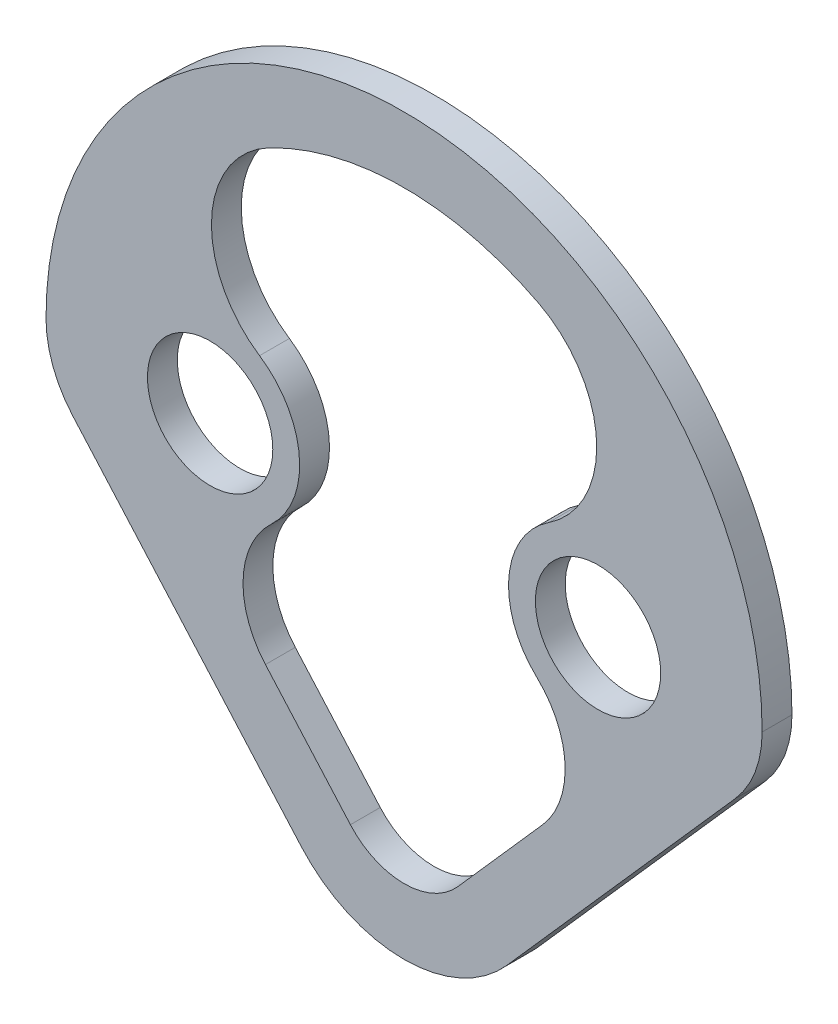
from build123d import *

# Parameters (mm, degrees)
SZKIC1_R                    = 10.5
DODANIE_WYCI_GNI_CIE1_DEPTH = 5


with BuildPart() as part:
    # Szkic1 → Dodanie-wyciągnięcie1 (new body)
    with BuildSketch(Plane.XY):
        with BuildLine():
            Line((-17.23880927, -15.225749734), (-55.491242037, 28.084195861))
            ThreePointArc((-55.491242037, 28.084195861), (-58.835117414, 33.629849165), (-60, 40))
            ThreePointArc((-60, 40), (0, 100), (60, 40))
            ThreePointArc((60, 40), (58.835117414, 33.629849165), (55.491242037, 28.084195861))
            Line((55.491242037, 28.084195861), (17.23880927, -15.225749734))
            ThreePointArc((17.23880927, -15.225749734), (0, -23), (-17.23880927, -15.225749734))
        make_face()
        with Locations((-32.5, 40)):
            Circle(SZKIC1_R, mode=Mode.SUBTRACT)
        with Locations((32.5, 40)):
            Circle(SZKIC1_R, mode=Mode.SUBTRACT)
        with BuildLine():
            Line((-23.232277997, 8.17672768), (-8.994161358, -7.943869426))
            ThreePointArc((-8.994161358, -7.943869426), (0, -12), (8.994161358, -7.943869426))
            Line((8.994161358, -7.943869426), (23.232277997, 8.17672768))
            ThreePointArc((23.232277997, 8.17672768), (26.972823751, 18.81529275), (22.24478815, 29.053282232))
            ThreePointArc((22.24478815, 29.053282232), (17.552836173, 41.257892492), (24.218531469, 52.506689369))
            ThreePointArc((24.218531469, 52.506689369), (32.255432897, 68.469423949), (22.572828784, 83.491003675))
            ThreePointArc((22.572828784, 83.491003675), (0, 89), (-22.572828784, 83.491003675))
            ThreePointArc((-22.572828784, 83.491003675), (-32.255432897, 68.469423949), (-24.218531469, 52.506689369))
            ThreePointArc((-24.218531469, 52.506689369), (-17.552836173, 41.257892492), (-22.24478815, 29.053282232))
            ThreePointArc((-22.24478815, 29.053282232), (-26.972823751, 18.81529275), (-23.232277997, 8.17672768))
        make_face(mode=Mode.SUBTRACT)
    extrude(amount=DODANIE_WYCI_GNI_CIE1_DEPTH)


solid = part.part
